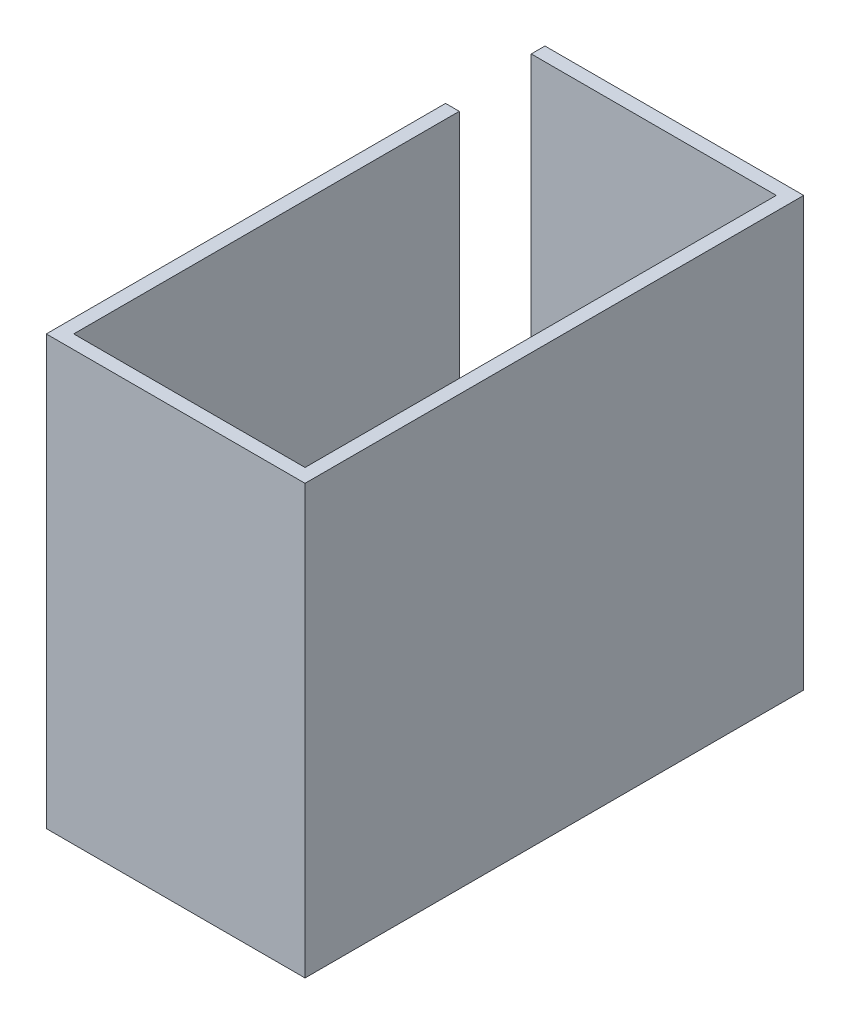
from build123d import *

# Parameters (mm, degrees)
BOSS_EXTRUDE2_DEPTH = 50
BOSS_EXTRUDE3_DEPTH = 15


with BuildPart() as part:
    # Sketch1 → Boss-Extrude2 (new body)
    with BuildSketch(Plane(origin=(0, 0, 0), x_dir=(1, 0, 0), z_dir=(0, 1, 0))):
        Polygon((13.5, -22.5), (-13.5, -22.5), (-13.5, 22.5), (-15.1, 22.5), (-15.1, -24.1), (15.1, -24.1), (15.1, 34.1), (-15.1, 34.1), (-15.1, 32.5), (13.5, 32.5), align=None)
    extrude(amount=BOSS_EXTRUDE2_DEPTH)

    # Sketch1<4> → Boss-Extrude3 (add)
    with BuildSketch(Plane(origin=(0, 0, 0), x_dir=(1, 0, 0), z_dir=(0, 1, 0))):
        Polygon((13.5, 32.5), (13.5, -22.5), (-13.5, -22.5), (-13.5, 22.5), (-15.1, 22.5), (-15.1, -24.1), (15.1, -24.1), (15.1, 34.1), (-15.1, 34.1), (-15.1, 32.5), align=None)
        Polygon((-13.5, -22.5), (13.5, -22.5), (13.5, 32.5), (-15.1, 32.5), (-15.1, 22.5), (-13.5, 22.5), align=None)
    extrude(amount=BOSS_EXTRUDE3_DEPTH)


solid = part.part
